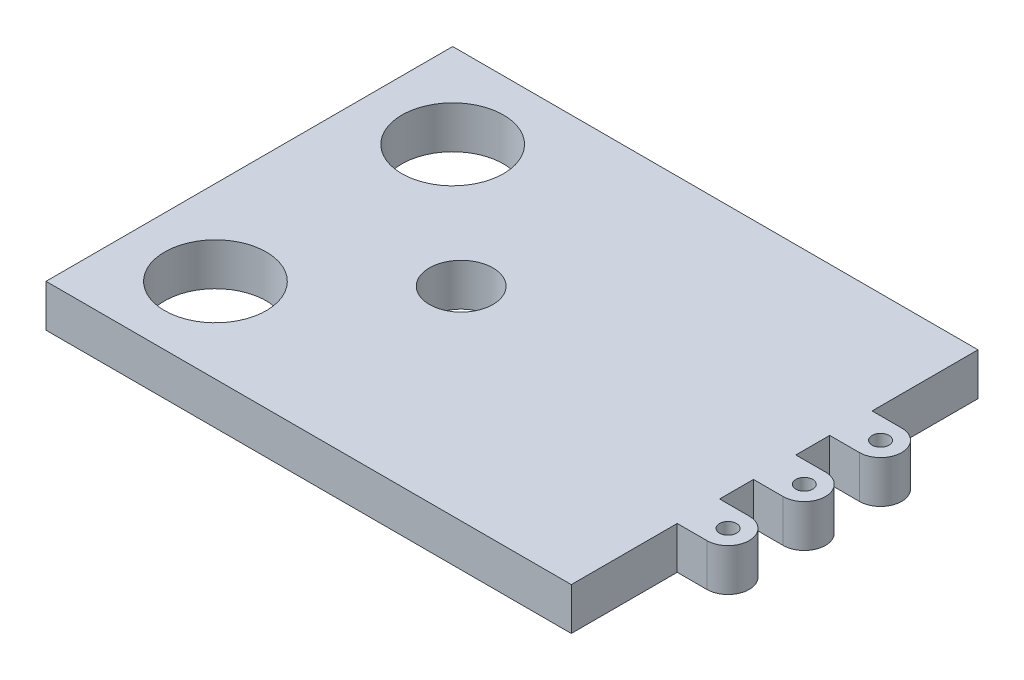
from build123d import *

# Parameters (mm, degrees)
SKETCH1_R           = 6
SKETCH1_R_2         = 3.75
SKETCH1_R_3         = 1
BOSS_EXTRUDE1_DEPTH = 5


with BuildPart() as part:
    # Sketch1 → Boss-Extrude1 (new body)
    with BuildSketch(Plane(origin=(0, 0, 0), x_dir=(1, 0, 0), z_dir=(0, 1, 0))):
        with BuildLine():
            Line((65.5, 12.5), (62, 12.5))
            Line((62, 12.5), (62, 0))
            Line((62, 0), (0, 0))
            Line((0, 0), (0, 48))
            Line((0, 48), (62, 48))
            Line((62, 48), (62, 35.5))
            Line((62, 35.5), (65.5, 35.5))
            ThreePointArc((65.5, 35.5), (68, 33), (65.5, 30.5))
            Line((65.5, 30.5), (62, 30.5))
            Line((62, 30.5), (62, 26.5))
            Line((62, 26.5), (65.5, 26.5))
            ThreePointArc((65.5, 26.5), (68, 24), (65.5, 21.5))
            Line((65.5, 21.5), (62, 21.5))
            Line((62, 21.5), (62, 17.5))
            Line((62, 17.5), (65.5, 17.5))
            ThreePointArc((65.5, 17.5), (68, 15), (65.5, 12.5))
        make_face()
        with Locations(Location((10, 10, 0), (0, 0, 270))):
            Circle(SKETCH1_R, mode=Mode.SUBTRACT)
        with Locations(Location((10, 38, 0), (0, 0, 270))):
            Circle(SKETCH1_R, mode=Mode.SUBTRACT)
        with Locations(Location((25, 24, 0), (0, 0, 270))):
            Circle(SKETCH1_R_2, mode=Mode.SUBTRACT)
        with Locations(Location((65.5, 15, 0), (0, 0, 270))):
            Circle(SKETCH1_R_3, mode=Mode.SUBTRACT)
        with Locations(Location((65.5, 24, 0), (0, 0, 270))):
            Circle(SKETCH1_R_3, mode=Mode.SUBTRACT)
        with Locations(Location((65.5, 33, 0), (0, 0, 270))):
            Circle(SKETCH1_R_3, mode=Mode.SUBTRACT)
    extrude(amount=BOSS_EXTRUDE1_DEPTH)


solid = part.part
